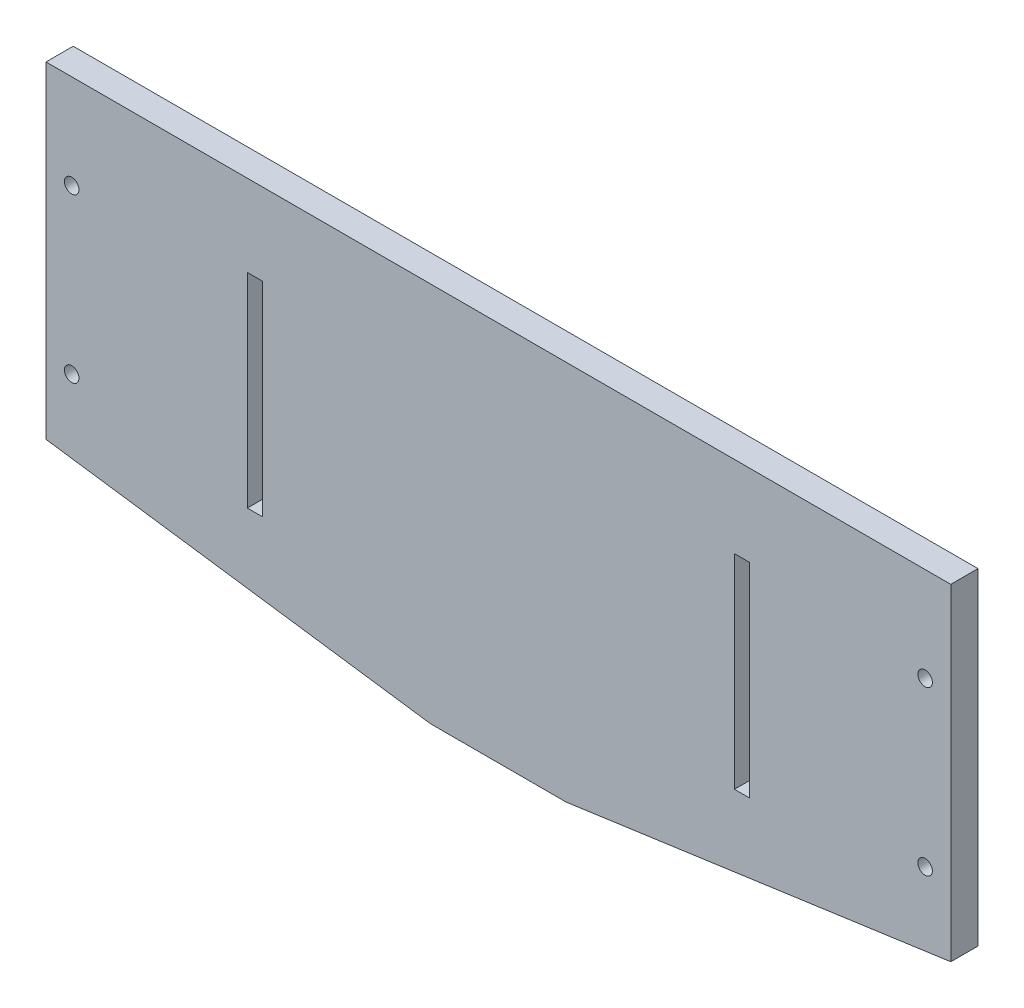
from build123d import *

# Parameters (mm, degrees)
SKETCH1_W            = 211.1756
SKETCH1_H            = 127
BOSS_EXTRUDE1_DEPTH  = 6.35
M3_CLEARANCE_HOLE1_D = 3.4
SKETCH4_W            = 3.5052
SKETCH4_H            = 47.625
CUT_EXTRUDE1_DEPTH   = 247.50447569
CUT_EXTRUDE2_DEPTH   = 247.50447569


with BuildPart() as part:
    # Sketch1 → Boss-Extrude1 (new body)
    with BuildSketch(Plane.XY):
        with Locations((105.5878, 63.5)):
            Rectangle(SKETCH1_W, SKETCH1_H)
    extrude(amount=BOSS_EXTRUDE1_DEPTH)

    # M3 Clearance Hole1 (through all)
    with Locations(Plane.XY.offset(6.35)):
        with Locations((5.9944, 105.0036), (5.9944, 66.9036), (205.1812, 66.9036), (205.1812, 105.0036)):
            Hole(M3_CLEARANCE_HOLE1_D / 2)

    # Sketch4 → Cut-Extrude1 (cut, through all)
    with BuildSketch(Plane.XY.offset(6.35)):
        with Locations((48.7426, 84.1375)):
            Rectangle(SKETCH4_W, SKETCH4_H)
        with Locations((162.433, 84.1375)):
            Rectangle(SKETCH4_W, SKETCH4_H)
    extrude(amount=-CUT_EXTRUDE1_DEPTH, mode=Mode.SUBTRACT)

    # Sketch5 → Cut-Extrude2 (cut, through all)
    with BuildSketch(Plane.XY.offset(6.35)):
        Polygon((0, 50.708311795), (89.7128, 38.1), (121.4628, 38.1), (211.1756, 50.708311795), (211.1756, 0), (0, 0), align=None)
    extrude(amount=-CUT_EXTRUDE2_DEPTH, mode=Mode.SUBTRACT)


solid = part.part
